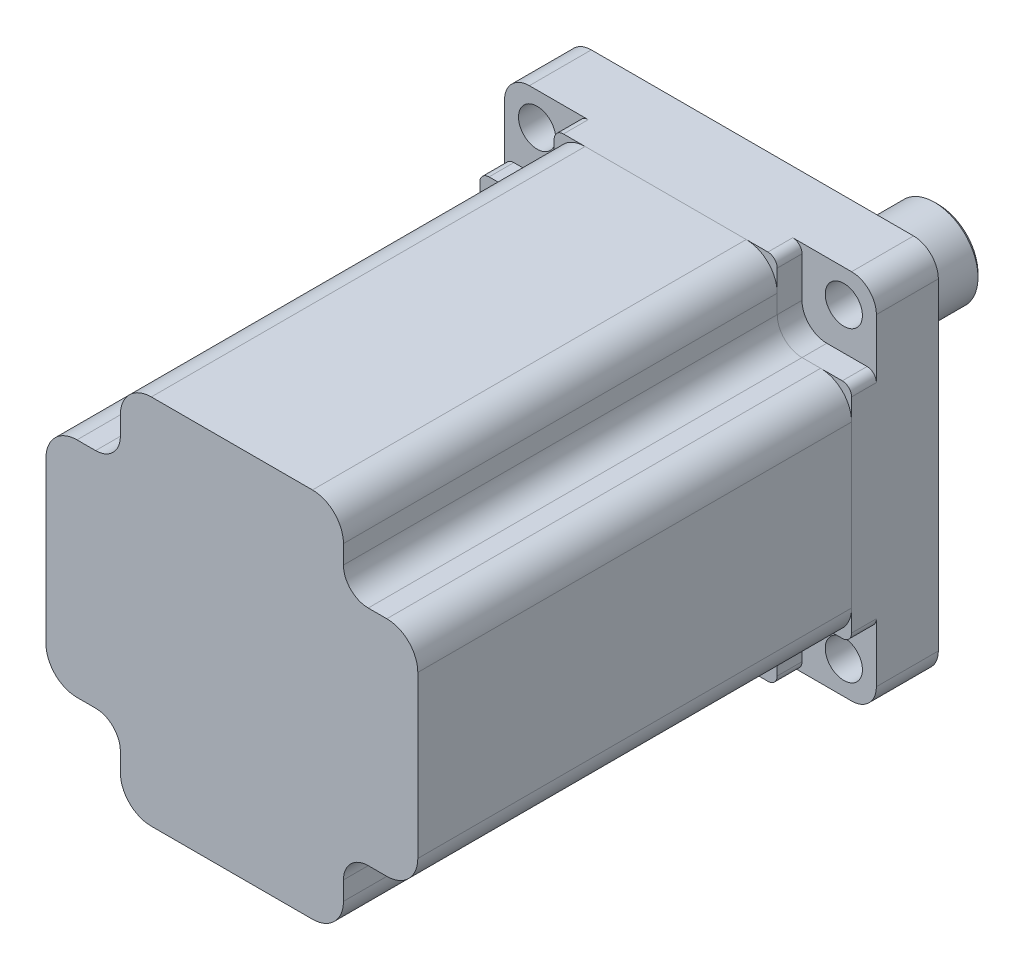
from build123d import *

# Parameters (mm, degrees)
SKETCH_1_W                = 60
SKETCH_1_H                = 60
EXTRUDE_1_DEPTH           = 14
SKETCH_2_W                = 4
SKETCH_2_H                = 12
CUT_EXTRUDE_1_DEPTH       = 12
SKETCH_3_W                = 12
SKETCH_3_H                = 4
CUT_EXTRUDE_2_DEPTH       = 12
SKETCH_4_W                = 4
SKETCH_4_H                = 12
CUT_EXTRUDE_3_DEPTH       = 12
SKETCH_5_W                = 4
SKETCH_5_H                = 12
CUT_EXTRUDE_4_DEPTH       = 12
HOLE_WIZARD_6_0_6_1_D     = 6
HOLE_WIZARD_6_0_6_1_DEPTH = 40
HOLE_WIZARD_6_0_6_2_D     = 6
HOLE_WIZARD_6_0_6_2_DEPTH = 14
CHAMFER_1_SIZE            = 0.6
FILLET_1_R                = 1.5
FILLET_2_R                = 4
SKETCH_15_W               = 75
SKETCH_15_H               = 60
EXTRUDE_2_DEPTH           = 60
SKETCH_21_W               = 12
SKETCH_21_H               = 12
CUT_EXTRUDE_5_DEPTH       = 87.168439698
SKETCH_43_W               = 12
SKETCH_43_H               = 12
CUT_EXTRUDE_7_DEPTH       = 87.168439698
SKETCH_50_W               = 12
SKETCH_50_H               = 12
CUT_EXTRUDE_8_DEPTH       = 87.168439698
SKETCH_57_W               = 12
SKETCH_57_H               = 12
CUT_EXTRUDE_9_DEPTH       = 87.168439698
FILLET_5_R                = 4
FILLET_6_R                = 5
SKETCH_58_W               = 5
SKETCH_58_H               = 60
CUT_EXTRUDE_10_DEPTH      = 86


with BuildPart() as part:
    # 草图1 → 凸台-拉伸1 (new body)
    with BuildSketch(Plane(origin=(0, 0, 0), x_dir=(-1, 0, 0), z_dir=(0, 0, -1))):
        Rectangle(SKETCH_1_W, SKETCH_1_H)
    extrude(amount=-EXTRUDE_1_DEPTH)

    # 草图2 → 切除-拉伸1 (cut)
    with BuildSketch(Plane(origin=(30, 0, 0), x_dir=(0, 0, -1), z_dir=(1, 0, 0))):
        with Locations((-12, 24)):
            Rectangle(SKETCH_2_W, SKETCH_2_H)
    extrude(amount=-CUT_EXTRUDE_1_DEPTH, mode=Mode.SUBTRACT)

    # 草图3 → 切除-拉伸2 (cut)
    with BuildSketch(Plane(origin=(0, 30, 0), x_dir=(-1, 0, 0), z_dir=(0, 1, 0))):
        with Locations((24, 12)):
            Rectangle(SKETCH_3_W, SKETCH_3_H)
    extrude(amount=-CUT_EXTRUDE_2_DEPTH, mode=Mode.SUBTRACT)

    # 草图4 → 切除-拉伸3 (cut)
    with BuildSketch(Plane.ZY.offset(30)):
        with Locations((12, -24)):
            Rectangle(SKETCH_4_W, SKETCH_4_H)
    extrude(amount=-CUT_EXTRUDE_3_DEPTH, mode=Mode.SUBTRACT)

    # 草图5 → 切除-拉伸4 (cut)
    with BuildSketch(Plane(origin=(30, 0, 0), x_dir=(0, 0, -1), z_dir=(1, 0, 0))):
        with Locations((-12, -24)):
            Rectangle(SKETCH_5_W, SKETCH_5_H)
    extrude(amount=-CUT_EXTRUDE_4_DEPTH, mode=Mode.SUBTRACT)

    # 草图6 → 旋转1 (revolve)
    with BuildSketch(Plane(origin=(0, 0, 0), x_dir=(1, 0, 0), z_dir=(0, 1, 0))):
        Polygon((7, 30), (0, 30), (0, 0), (20, 0), (20, 3), (7, 3), align=None)
    revolve(axis=Axis((0, 0, -30), (0, 0, 1)))

    # Ø6.0 (6) 直径孔1
    with Locations(Plane.XY.offset(10)):
        with Locations((-24.748737342, -24.748737342), (24.748737342, -24.748737342)):
            Hole(HOLE_WIZARD_6_0_6_1_D / 2, depth=HOLE_WIZARD_6_0_6_1_DEPTH)

    # Ø6.0 (6) 直径孔2
    with Locations(Plane(origin=(0, 0, 0), x_dir=(-1, 0, 0), z_dir=(0, 0, -1))):
        with Locations((24.748737342, 24.748737342), (-24.748737342, 24.748737342)):
            Hole(HOLE_WIZARD_6_0_6_2_D / 2, depth=HOLE_WIZARD_6_0_6_2_DEPTH)

    # 倒角1
    chamfer_1_edges = [part.edges().sort_by_distance(p)[0] for p in [
        (-7, 0, -30),
    ]]
    chamfer(chamfer_1_edges, length=CHAMFER_1_SIZE)

    # 圆角1
    fillet_1_edges = [part.edges().sort_by_distance(p)[0] for p in [
        (18, 30, 12),
        (30, 18, 12),
        (-30, 18, 12),
        (-18, 30, 12),
        (-18, -30, 12),
        (-30, -18, 12),
        (18, -30, 12),
        (30, -18, 12),
    ]]
    fillet(fillet_1_edges, radius=FILLET_1_R)

    # 圆角2
    fillet_2_edges = [part.edges().sort_by_distance(p)[0] for p in [
        (30, 30, 5),
        (18, 18, 12),
        (-30, 30, 5),
        (-18, 18, 12),
        (-30, -30, 5),
        (-18, -18, 12),
        (30, -30, 5),
        (18, -18, 12),
    ]]
    fillet(fillet_2_edges, radius=FILLET_2_R)


with BuildPart() as body_2:
    # 草图15 → 凸台-拉伸2 (new body)
    with BuildSketch(Plane(origin=(30, 0, 0), x_dir=(0, 0, -1), z_dir=(1, 0, 0))):
        with Locations((-51.5, 0)):
            Rectangle(SKETCH_15_W, SKETCH_15_H)
    extrude(amount=-EXTRUDE_2_DEPTH)

    # 草图21 → 切除-拉伸5 (cut, through all)
    with BuildSketch(Plane(origin=(0, 0, 14), x_dir=(-1, 0, 0), z_dir=(0, 0, -1))):
        with Locations((24, -24)):
            Rectangle(SKETCH_21_W, SKETCH_21_H)
    extrude(amount=-CUT_EXTRUDE_5_DEPTH, mode=Mode.SUBTRACT)

    # 草图43 → 切除-拉伸7 (cut, through all)
    with BuildSketch(Plane(origin=(0, 0, 14), x_dir=(-1, 0, 0), z_dir=(0, 0, -1))):
        with Locations((-24, -24)):
            Rectangle(SKETCH_43_W, SKETCH_43_H)
    extrude(amount=-CUT_EXTRUDE_7_DEPTH, mode=Mode.SUBTRACT)

    # 草图50 → 切除-拉伸8 (cut, through all)
    with BuildSketch(Plane(origin=(0, 0, 14), x_dir=(-1, 0, 0), z_dir=(0, 0, -1))):
        with Locations((-24, 24)):
            Rectangle(SKETCH_50_W, SKETCH_50_H)
    extrude(amount=-CUT_EXTRUDE_8_DEPTH, mode=Mode.SUBTRACT)

    # 草图57 → 切除-拉伸9 (cut, through all)
    with BuildSketch(Plane(origin=(0, 0, 14), x_dir=(-1, 0, 0), z_dir=(0, 0, -1))):
        with Locations((24, 24)):
            Rectangle(SKETCH_57_W, SKETCH_57_H)
    extrude(amount=-CUT_EXTRUDE_9_DEPTH, mode=Mode.SUBTRACT)

    # 圆角5
    fillet_5_edges = [body_2.edges().sort_by_distance(p)[0] for p in [
        (-18, -18, 51.5),
        (18, -18, 51.5),
        (18, 18, 51.5),
        (-18, 18, 51.5),
    ]]
    fillet(fillet_5_edges, radius=FILLET_5_R)

    # 圆角6
    fillet_6_edges = [body_2.edges().sort_by_distance(p)[0] for p in [
        (-30, -18, 51.5),
        (-18, -30, 51.5),
        (18, -30, 51.5),
        (30, -18, 51.5),
        (30, 18, 51.5),
        (18, 30, 51.5),
        (-18, 30, 51.5),
        (-30, 18, 51.5),
    ]]
    fillet(fillet_6_edges, radius=FILLET_6_R)

    # 草图58 → 切除-拉伸10 (cut)
    with BuildSketch(Plane(origin=(30, 0, 0), x_dir=(0, 0, -1), z_dir=(1, 0, 0))):
        with Locations((-86.5, 0)):
            Rectangle(SKETCH_58_W, SKETCH_58_H)
    extrude(amount=-CUT_EXTRUDE_10_DEPTH, mode=Mode.SUBTRACT)


solid = Compound([part.part, body_2.part])
